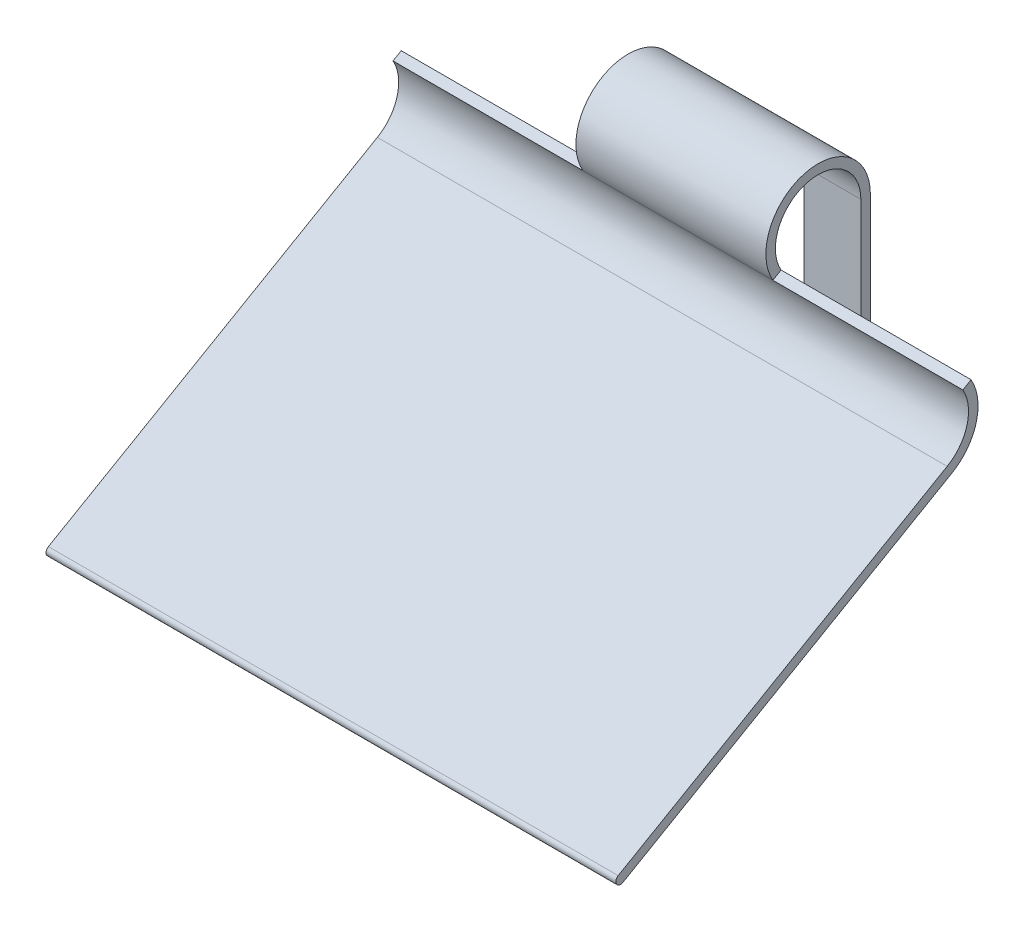
from build123d import *

# Parameters (mm, degrees)
BOSS_EXTRUDE1_DEPTH      = 76.2
BOSS_EXTRUDE1_DEPTH_BACK = 76.2
BOSS_EXTRUDE3_DEPTH      = 25.4
BOSS_EXTRUDE3_DEPTH_BACK = 25.4
CUT_EXTRUDE2_DEPTH       = 3.81


with BuildPart() as part:
    # Sketch1 → Boss-Extrude1 (new, two sides: drawn at the far end of the back side and taken through both)
    with BuildSketch(Plane.YZ.offset(-BOSS_EXTRUDE1_DEPTH_BACK)):
        with BuildLine():
            Line((17.983522628, -5.748374891), (16.713522628, -3.548670365))
            ThreePointArc((16.713522628, -3.548670365), (8.040220943, -4.690532194), (1.099852263, 0.635))
            Line((1.099852263, 0.635), (-49.698657582, 88.6206))
            ThreePointArc((-49.698657582, 88.6206), (-51.433509845, 89.085452263), (-51.898362108, 87.3506))
            Line((-51.898362108, 87.3506), (-1.099852263, -0.635))
            ThreePointArc((-1.099852263, -0.635), (7.382820568, -7.143983793), (17.983522628, -5.748374891))
        make_face()
    extrude(amount=BOSS_EXTRUDE1_DEPTH + BOSS_EXTRUDE1_DEPTH_BACK)

    # Sketch1<5> → Boss-Extrude3 (add, two sides: drawn at the far end of the back side and taken through both)
    with BuildSketch(Plane.YZ.offset(-BOSS_EXTRUDE3_DEPTH_BACK)):
        with BuildLine():
            Line((-50.798509845, -29.617045256), (23.698522628, -29.617045256))
            ThreePointArc((23.698522628, -29.617045256), (37.192506421, -12.031343196), (16.713522628, -3.548670365))
            Line((16.713522628, -3.548670365), (17.983522628, -5.748374891))
            ThreePointArc((17.983522628, -5.748374891), (34.739054823, -12.688743571), (23.698522628, -27.077045256))
            Line((23.698522628, -27.077045256), (-50.798509845, -27.077045256))
            ThreePointArc((-50.798509845, -27.077045256), (-52.068509845, -28.347045256), (-50.798509845, -29.617045256))
        make_face()
    extrude(amount=BOSS_EXTRUDE3_DEPTH + BOSS_EXTRUDE3_DEPTH_BACK)

    # Sketch5 → Cut-Extrude2 (cut)
    with BuildSketch(Plane(origin=(0, 0, -29.617045256), x_dir=(1, 0, 0), z_dir=(0, 0, -1))):
        Polygon((10.16, 50.798509845), (10.16, -23.698522628), (-10.16, -23.698522628), (-10.16, 50.798509845), (-10.16, 53.498166753), (0, 53.498166753), (10.16, 53.498166753), align=None)
    extrude(amount=-CUT_EXTRUDE2_DEPTH, mode=Mode.SUBTRACT)


solid = part.part
